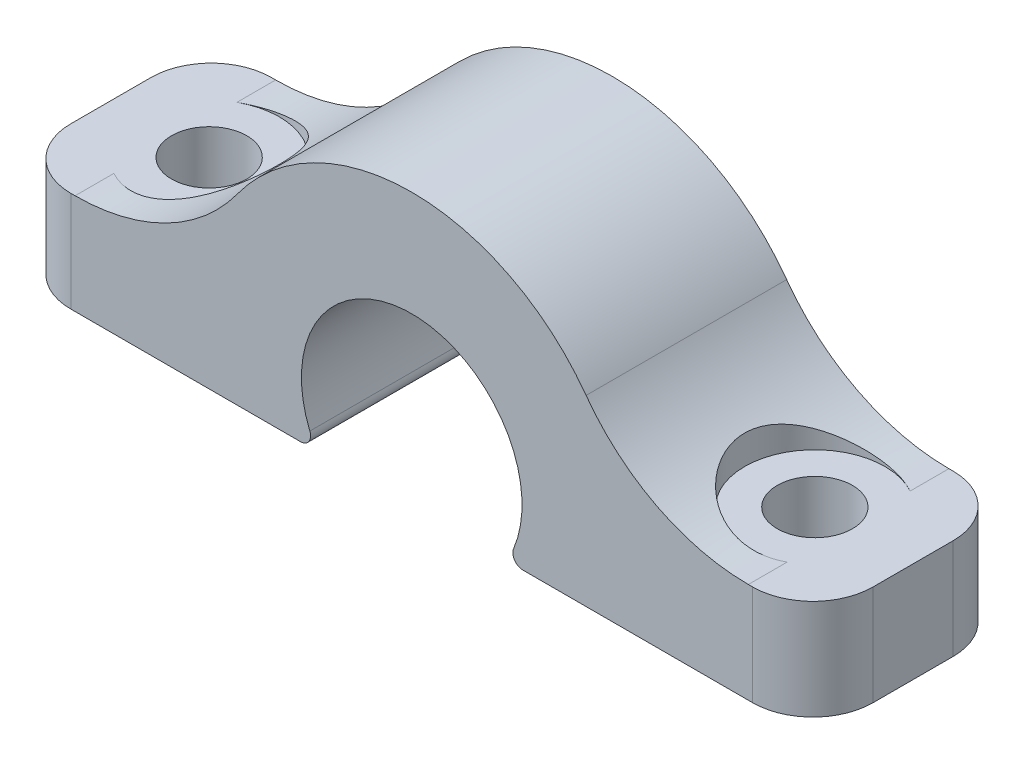
from build123d import *

# Parameters (mm, degrees)
BOSS_EXTRUDE1_START      = -1
SKETCH1_W                = 40
SKETCH1_H                = 10
BOSS_EXTRUDE1_DEPTH      = 5
BOSS_EXTRUDE2_DEPTH      = 5
BOSS_EXTRUDE2_DEPTH_BACK = 5
SKETCH3_W                = 10
SKETCH3_H                = 10
BOSS_EXTRUDE3_DEPTH      = 5
FILLET1_R                = 3
FILLET2_R                = 3
FILLET3_R                = 0.5
FILLET4_R                = 10
CUT_EXTRUDE1_DEPTH       = 25.669870287
CUT_EXTRUDE1_DEPTH_BACK  = 25.669870287
SKETCH4_R                = 1.875
CUT_EXTRUDE2_START       = 5
SKETCH5_R                = 3.5
CUT_EXTRUDE2_DEPTH       = 10
SKETCH7_W                = 51.703075982
SKETCH7_H                = 23.04476915
CUT_EXTRUDE4_DEPTH       = 25.669870308


with BuildPart() as part:
    # Sketch1 → Boss-Extrude1 (new body)
    with BuildSketch(Plane(origin=(0, 0, 0), x_dir=(1, 0, 0), z_dir=(0, 1, 0)).offset(BOSS_EXTRUDE1_START)):
        Rectangle(SKETCH1_W, SKETCH1_H)
    extrude(amount=-BOSS_EXTRUDE1_DEPTH)

    # Fillet2
    fillet2_edges = [part.edges().sort_by_distance(p)[0] for p in [
        (-20, -3.5, 5),
        (-20, -3.5, -5),
        (20, -3.5, 5),
        (20, -3.5, -5),
    ]]
    fillet(fillet2_edges, radius=FILLET2_R)


with BuildPart() as body_2:
    # Sketch2 → Boss-Extrude2 (new, two sides: drawn at the far end of the back side and taken through both)
    with BuildSketch(Plane.XY.offset(-BOSS_EXTRUDE2_DEPTH_BACK)):
        with BuildLine():
            Line((-10.378945033, 0), (-4.733920151, 0))
            ThreePointArc((-4.733920151, 0), (0, 8.3), (4.733920151, 0))
            Line((4.733920151, 0), (10.378945033, 0))
            ThreePointArc((10.378945033, 0), (0, 13.55), (-10.378945033, 0))
        make_face()
    extrude(amount=BOSS_EXTRUDE2_DEPTH + BOSS_EXTRUDE2_DEPTH_BACK)

    # Sketch3 → Boss-Extrude3 (add)
    with BuildSketch(Plane(origin=(0, 0, 0), x_dir=(1, 0, 0), z_dir=(0, 1, 0))):
        with Locations((-15, 0)):
            Rectangle(SKETCH3_W, SKETCH3_H)
        with Locations((15, 0)):
            Rectangle(SKETCH3_W, SKETCH3_H)
    extrude(amount=BOSS_EXTRUDE3_DEPTH)

    # Fillet1
    fillet1_edges = [body_2.edges().sort_by_distance(p)[0] for p in [
        (20, 2.5, -5),
        (20, 2.5, 5),
        (-20, 2.5, -5),
        (-20, 2.5, 5),
    ]]
    fillet(fillet1_edges, radius=FILLET1_R)

    # Fillet3
    fillet3_edges = [body_2.edges().sort_by_distance(p)[0] for p in [
        (-4.733920151, 0, 0),
        (4.733920151, 0, 0),
    ]]
    fillet(fillet3_edges, radius=FILLET3_R)

    # Fillet4
    fillet4_edges = [body_2.edges().sort_by_distance(p)[0] for p in [
        (10.522475944, 5, 0),
        (-10.522475944, 5, 0),
    ]]
    fillet(fillet4_edges, radius=FILLET4_R)


with BuildPart() as cut_extrude1_tool:
    # Sketch4 → Cut-Extrude1 (new, two sides: drawn at the far end of the back side and taken through both)
    with BuildSketch(Plane(origin=(0, 0, 0), x_dir=(1, 0, 0), z_dir=(0, 1, 0)).offset(-CUT_EXTRUDE1_DEPTH_BACK)):
        with Locations((-15.1, 0)):
            Circle(SKETCH4_R)
        with Locations((15.1, 0)):
            Circle(SKETCH4_R)
    extrude(amount=CUT_EXTRUDE1_DEPTH + CUT_EXTRUDE1_DEPTH_BACK)


with BuildPart() as part_1:
    add(part.part)

    # Cut-Extrude1: cut by cut_extrude1_tool
    add(cut_extrude1_tool.part, mode=Mode.SUBTRACT)

    # Sketch7 → Cut-Extrude4 (cut, through all)
    with BuildSketch(Plane(origin=(0, 0, 0), x_dir=(1, 0, 0), z_dir=(0, 1, 0))):
        with Locations((-1.693322056, -1.721439234)):
            Rectangle(SKETCH7_W, SKETCH7_H)
    extrude(amount=-CUT_EXTRUDE4_DEPTH, mode=Mode.SUBTRACT)


with BuildPart() as body_2_1:
    add(body_2.part)

    # Cut-Extrude1: cut by cut_extrude1_tool
    add(cut_extrude1_tool.part, mode=Mode.SUBTRACT)

    # Sketch5 → Cut-Extrude2 (cut)
    with BuildSketch(Plane(origin=(0, 0, 0), x_dir=(1, 0, 0), z_dir=(0, 1, 0)).offset(CUT_EXTRUDE2_START)):
        with Locations((-15.1, 0)):
            Circle(SKETCH5_R)
        with Locations((15.1, 0)):
            Circle(SKETCH5_R)
    extrude(amount=CUT_EXTRUDE2_DEPTH, mode=Mode.SUBTRACT)


solid = body_2_1.part
